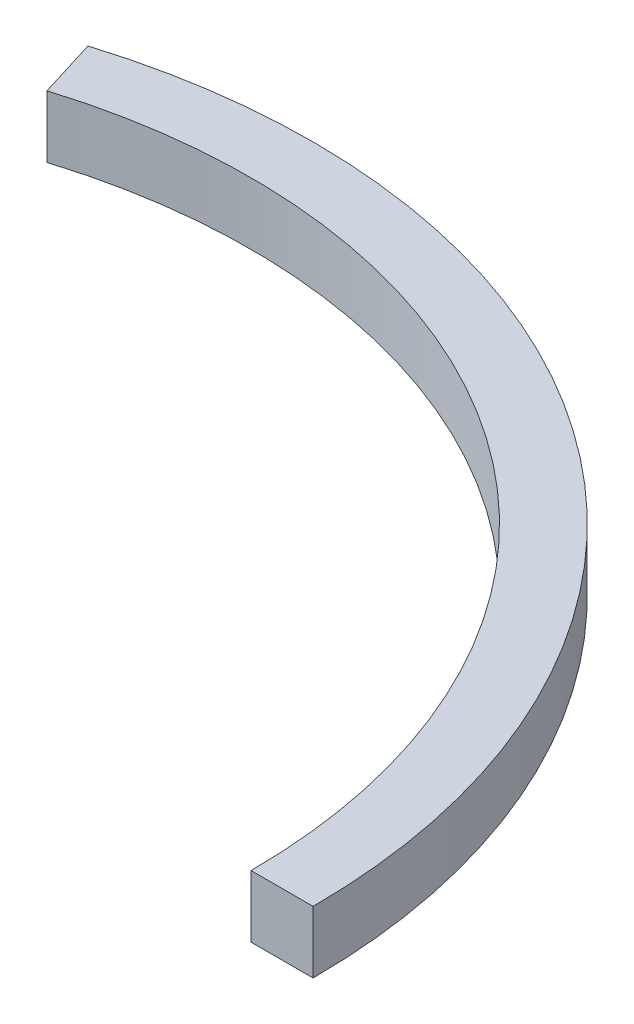
from build123d import *

# Parameters (mm, degrees)
SKETCH1_W = 5
SKETCH1_H = 5


with BuildPart() as part:
    # Sweep1: sweep along a path in Sketch3
    with BuildLine(Plane(origin=(0, 5.017053677, 0), x_dir=(1, 0, 0), z_dir=(0, 1, 0))) as sweep1_path:
        ThreePointArc((42.800213466, 0), (26.134836566, 32.997365327), (-10.313255731, 39.169680418))
    # Sketch1 → Sweep1 (sweep)
    with BuildSketch(Plane.XY):
        with Locations((52.655726896, 1.374746178)):
            Rectangle(SKETCH1_W, SKETCH1_H)
    sweep(path=sweep1_path.line)


solid = part.part
